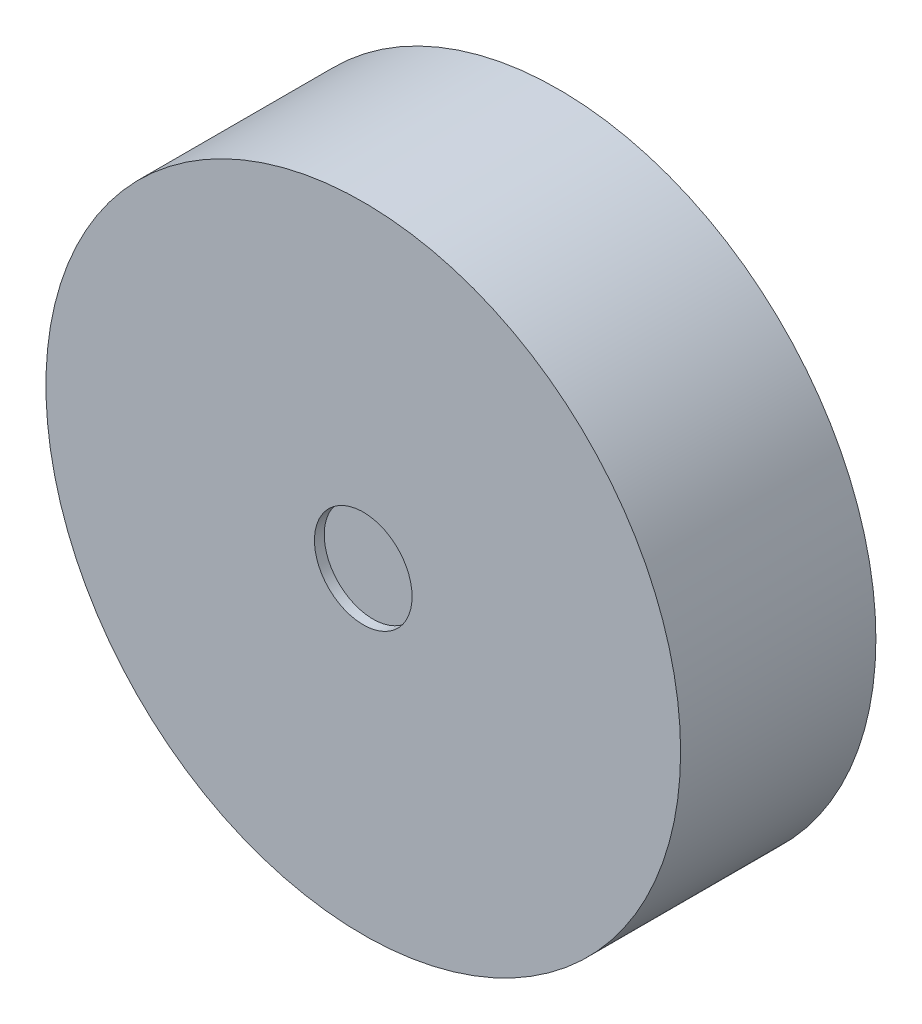
from build123d import *

# Parameters (mm, degrees)
SKETCH1_R           = 32.5
BOSS_EXTRUDE1_DEPTH = 20
SKETCH2_R           = 5
CUT_EXTRUDE1_DEPTH  = 1
SKETCH4_R           = 3.05
CUT_EXTRUDE2_DEPTH  = 4.5
SKETCH3_R           = 1.5
CUT_EXTRUDE3_DEPTH  = 2
CUT_EXTRUDE4_START  = -2
SKETCH5_R           = 5
CUT_EXTRUDE4_DEPTH  = 2


with BuildPart() as part:
    # Sketch1 → Boss-Extrude1 (new body)
    with BuildSketch(Plane.XY):
        Circle(SKETCH1_R)
    extrude(amount=BOSS_EXTRUDE1_DEPTH)

    # Sketch2 → Cut-Extrude1 (cut)
    with BuildSketch(Plane.XY.offset(20)):
        Circle(SKETCH2_R)
    extrude(amount=-CUT_EXTRUDE1_DEPTH, mode=Mode.SUBTRACT)

    # Sketch4 → Cut-Extrude2 (cut)
    with BuildSketch(Plane(origin=(0, 0, 0), x_dir=(-1, 0, 0), z_dir=(0, 0, -1))):
        Circle(SKETCH4_R)
    extrude(amount=-CUT_EXTRUDE2_DEPTH, mode=Mode.SUBTRACT)

    # Sketch3 → Cut-Extrude3 (cut)
    with BuildSketch(Plane(origin=(0, 0, 0), x_dir=(-1, 0, 0), z_dir=(0, 0, -1))):
        with Locations((5.5, 9)):
            Circle(SKETCH3_R)
        with Locations((-5.5, 9)):
            Circle(SKETCH3_R)
        with Locations((5.5, -9)):
            Circle(SKETCH3_R)
        with Locations((-5.5, -9)):
            Circle(SKETCH3_R)
    extrude(amount=-CUT_EXTRUDE3_DEPTH, mode=Mode.SUBTRACT)

    # Sketch5 → Cut-Extrude4 (cut)
    with BuildSketch(Plane(origin=(0, 0, 0), x_dir=(-1, 0, 0), z_dir=(0, 0, -1)).offset(CUT_EXTRUDE4_START)):
        with Locations(Location((0, 0, 0), (0, 0, 180))):
            Circle(SKETCH5_R)
    extrude(amount=CUT_EXTRUDE4_DEPTH, mode=Mode.SUBTRACT)


solid = part.part
